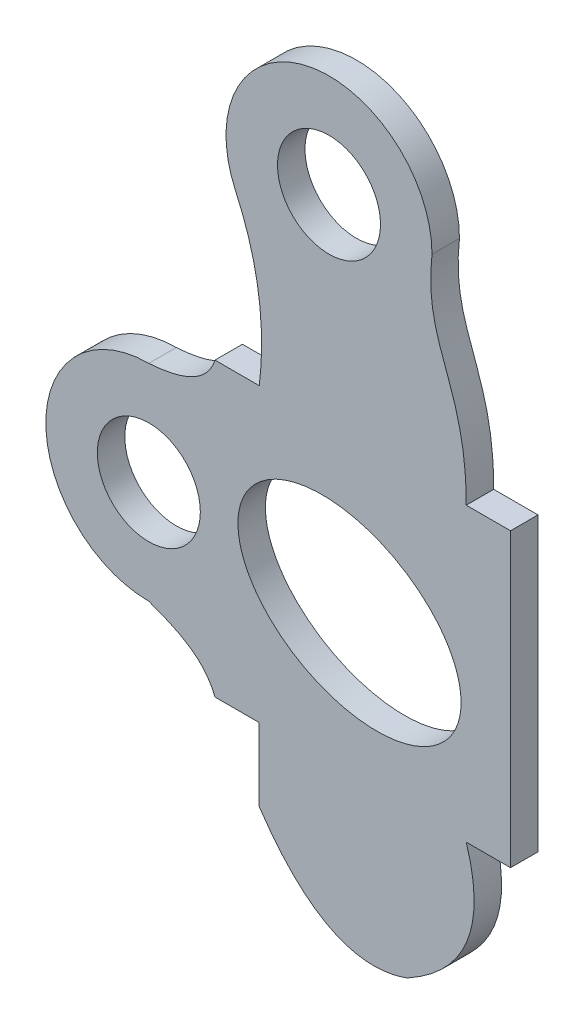
from build123d import *

# Parameters (mm, degrees)
SKETCH1_R           = 3
BOSS_EXTRUDE1_DEPTH = 1.6


with BuildPart() as part:
    # Sketch1 → Boss-Extrude1 (new body)
    with BuildSketch(Plane.XY):
        with BuildLine():
            Line((-6.644465822, -28.664524039), (-4.064465822, -28.664524039))
            Line((-4.064465822, -28.664524039), (-4.064465822, -32.904424552))
            add(Edge.make_bspline(
                [(-4.064465822, -32.904424552), (-1.365510938, -36.917800325), (1.536294354, -38.343358605), (4.556835996, -37.238093964)],
                knots=[0, 0, 0, 0, 1, 1, 1, 1], degree=3))
            add(Edge.make_bspline(
                [(4.556835996, -37.238093964), (7.353489091, -35.694657852), (9.41088737, -33.146691789), (7.995534178, -28.664524039)],
                knots=[0, 0, 0, 0, 1, 1, 1, 1], degree=3))
            Line((7.995534178, -28.664524039), (10.575534178, -28.664524039))
            Line((10.575534178, -28.664524039), (10.575534178, -11.664524039))
            Line((10.575534178, -11.664524039), (7.995534178, -11.664524039))
            add(Edge.make_bspline(
                [(6, 0), (5.453905424, -4.814667835), (8.010320044, -5.602020877), (7.995534178, -11.664524039)],
                knots=[0, 0, 0, 0, 1, 1, 1, 1], degree=3))
            ThreePointArc((6, 0), (-1.262242012, 5.865726306), (-5.468915034, -2.467988726))
            add(Edge.make_bspline(
                [(-5.468915034, -2.467988726), (-5.451568973, -2.50549931), (-5.434417979, -2.543049593)],
                knots=[0, 0, 0, 0.008656235, 0.008656235, 0.008656235], degree=2))
            add(Edge.make_bspline(
                [(-5.434417979, -2.543049593), (-3.47022328, -6.843445658), (-4.064465822, -11.664524039)],
                knots=[0.008656235, 0.008656235, 0.008656235, 1, 1, 1], degree=2))
            Line((-4.064465822, -11.664524039), (-6.644465822, -11.664524039))
            add(Edge.make_bspline(
                [(-6.644465822, -11.664524039), (-7.217619866, -13.544357503), (-10.496410649, -13.756608302)],
                knots=[0, 0, 0, 1, 1, 1], degree=2))
            ThreePointArc((-10.496410649, -13.756608302), (-16.496410649, -19.756608302), (-10.496410649, -25.756608302))
            add(Edge.make_bspline(
                [(-10.496410649, -25.756608302), (-8.769714825, -26.393979166), (-7.268928229, -27.053578359), (-6.644465822, -28.664524039)],
                knots=[0, 0, 0, 0, 1, 1, 1, 1], degree=3))
        make_face()
        with Locations((-10.496410649, -19.756608302)):
            Circle(SKETCH1_R, mode=Mode.SUBTRACT)
        with BuildLine():
            add(Edge.make_bspline(
                [(-5.018334994, -17.811300046), (-8.328810913, -25.457583709), (2.645688957, -25.669237538), (13.620188826, -25.880891366), (5.956164876, -18.022953875), (-1.707859075, -10.165016383), (-5.018334994, -17.811300046)],
                knots=[0, 0, 0, 2.094395102, 2.094395102, 4.188790205, 4.188790205, 6.283185307, 6.283185307, 6.283185307], degree=2, weights=[1, 0.5, 1, 0.5, 1, 0.5, 1]))
        make_face(mode=Mode.SUBTRACT)
        Circle(SKETCH1_R, mode=Mode.SUBTRACT)
    extrude(amount=BOSS_EXTRUDE1_DEPTH)


solid = part.part
